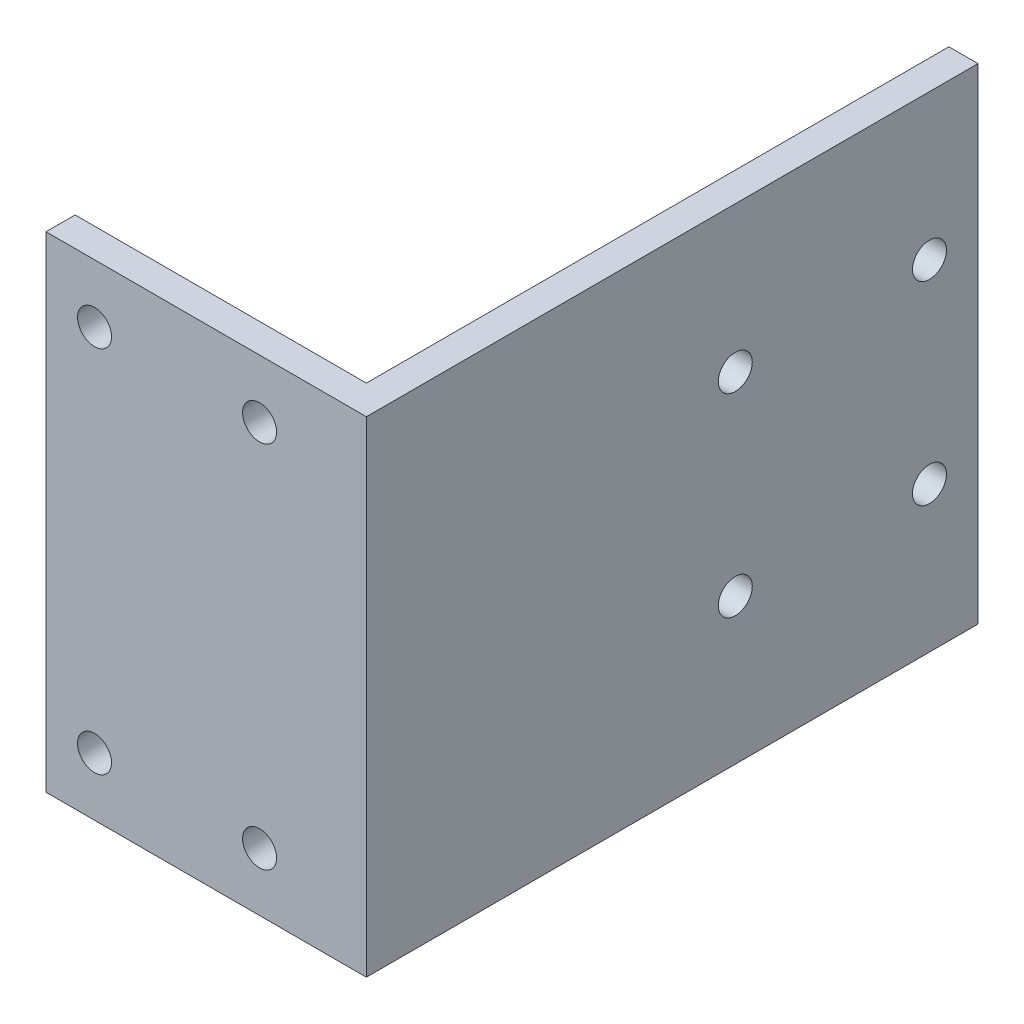
from build123d import *

# Parameters (mm, degrees)
EXTRUDE_1_DEPTH     = 50
SKETCH_2_R          = 1.75
CUT_EXTRUDE_1_DEPTH = 85.787970845
CUT_EXTRUDE_2_REACH = 86.788
SKETCH_3_R          = 1.75


with BuildPart() as part:
    # 草图1 → 凸台-拉伸1 (new body)
    with BuildSketch(Plane(origin=(0, 0, 0), x_dir=(1, 0, 0), z_dir=(0, 1, 0))):
        Polygon((0, 0), (30, 0), (30, 60), (33, 60), (33, -3), (0, -3), align=None)
    extrude(amount=EXTRUDE_1_DEPTH)

    # 草图2 → 切除-拉伸1 (cut, through all)
    with BuildSketch(Plane(origin=(0, 0, 0), x_dir=(-1, 0, 0), z_dir=(0, 0, -1))):
        with Locations((-22, 6)):
            Circle(SKETCH_2_R)
        with Locations((-22, 44)):
            Circle(SKETCH_2_R)
        with Locations((-5, 44)):
            Circle(SKETCH_2_R)
        with Locations((-5, 6)):
            Circle(SKETCH_2_R)
    extrude(amount=-CUT_EXTRUDE_1_DEPTH, mode=Mode.SUBTRACT)

    # 草图3 → 切除-拉伸2 (cut, up to next)
    with BuildSketch(Plane(origin=(33, 0, 0), x_dir=(0, 0, -1), z_dir=(1, 0, 0)), mode=Mode.PRIVATE) as cut_extrude_2_sk1:
        with Locations((55, 35)):
            Circle(SKETCH_3_R)
    cut_extrude_2_tool1 = extrude(cut_extrude_2_sk1.sketch, amount=-CUT_EXTRUDE_2_REACH, mode=Mode.PRIVATE) & part.part
    # 草图3 → 切除-拉伸2 (cut, up to next)
    with BuildSketch(Plane(origin=(33, 0, 0), x_dir=(0, 0, -1), z_dir=(1, 0, 0)), mode=Mode.PRIVATE) as cut_extrude_2_sk2:
        with Locations((55, 15)):
            Circle(SKETCH_3_R)
    cut_extrude_2_tool2 = extrude(cut_extrude_2_sk2.sketch, amount=-CUT_EXTRUDE_2_REACH, mode=Mode.PRIVATE) & part.part
    # 草图3 → 切除-拉伸2 (cut, up to next)
    with BuildSketch(Plane(origin=(33, 0, 0), x_dir=(0, 0, -1), z_dir=(1, 0, 0)), mode=Mode.PRIVATE) as cut_extrude_2_sk3:
        with Locations((35, 35)):
            Circle(SKETCH_3_R)
    cut_extrude_2_tool3 = extrude(cut_extrude_2_sk3.sketch, amount=-CUT_EXTRUDE_2_REACH, mode=Mode.PRIVATE) & part.part
    # 草图3 → 切除-拉伸2 (cut, up to next)
    with BuildSketch(Plane(origin=(33, 0, 0), x_dir=(0, 0, -1), z_dir=(1, 0, 0)), mode=Mode.PRIVATE) as cut_extrude_2_sk4:
        with Locations((35, 15)):
            Circle(SKETCH_3_R)
    cut_extrude_2_tool4 = extrude(cut_extrude_2_sk4.sketch, amount=-CUT_EXTRUDE_2_REACH, mode=Mode.PRIVATE) & part.part
    add(cut_extrude_2_tool1.solids().sort_by_distance((33, 35, -55))[0], mode=Mode.SUBTRACT)
    add(cut_extrude_2_tool2.solids().sort_by_distance((33, 15, -55))[0], mode=Mode.SUBTRACT)
    add(cut_extrude_2_tool3.solids().sort_by_distance((33, 35, -35))[0], mode=Mode.SUBTRACT)
    add(cut_extrude_2_tool4.solids().sort_by_distance((33, 15, -35))[0], mode=Mode.SUBTRACT)


solid = part.part
